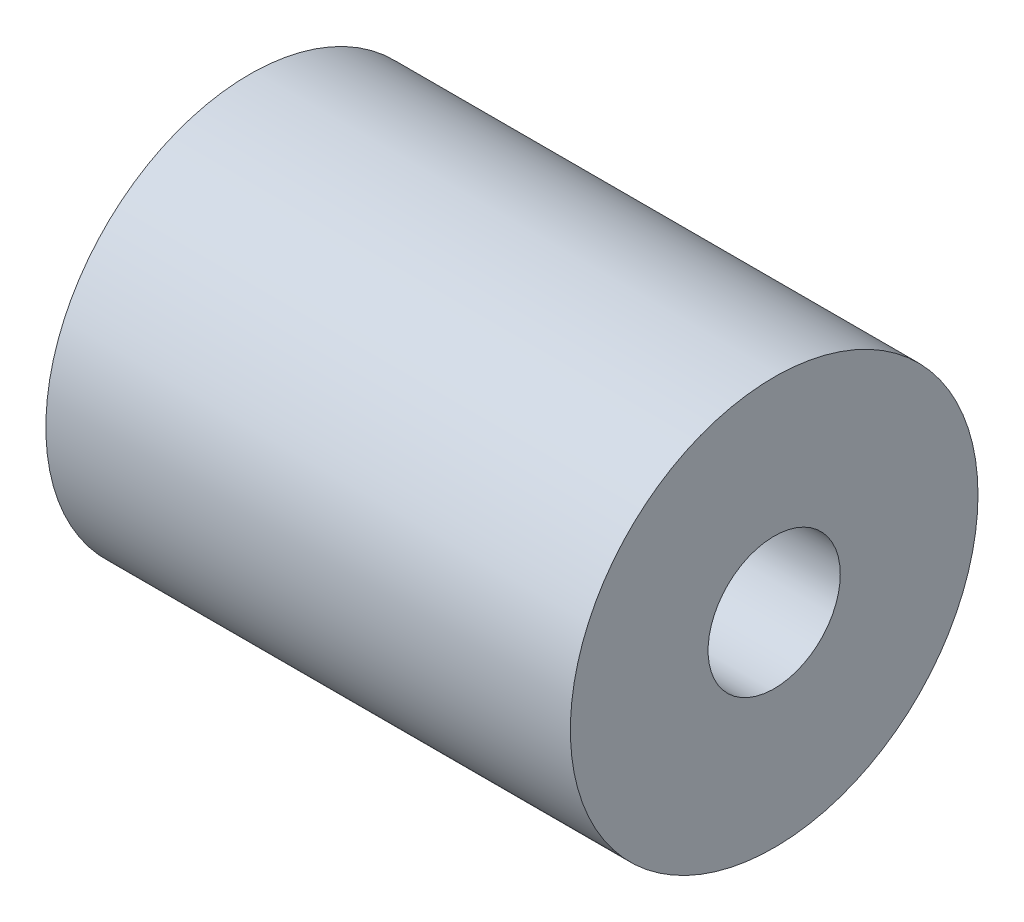
from build123d import *

# Parameters (mm, degrees)
SKETCH1_R           = 9.715
SKETCH1_R_2         = 3.15
BOSS_EXTRUDE1_DEPTH = 25


with BuildPart() as part:
    # Sketch1 → Boss-Extrude1 (new body)
    with BuildSketch(Plane(origin=(0, 0, 0), x_dir=(0, 0, -1), z_dir=(1, 0, 0))):
        with Locations((0, 9.465)):
            Circle(SKETCH1_R)
        with Locations((0, 9.465)):
            Circle(SKETCH1_R_2, mode=Mode.SUBTRACT)
    extrude(amount=BOSS_EXTRUDE1_DEPTH)


solid = part.part
